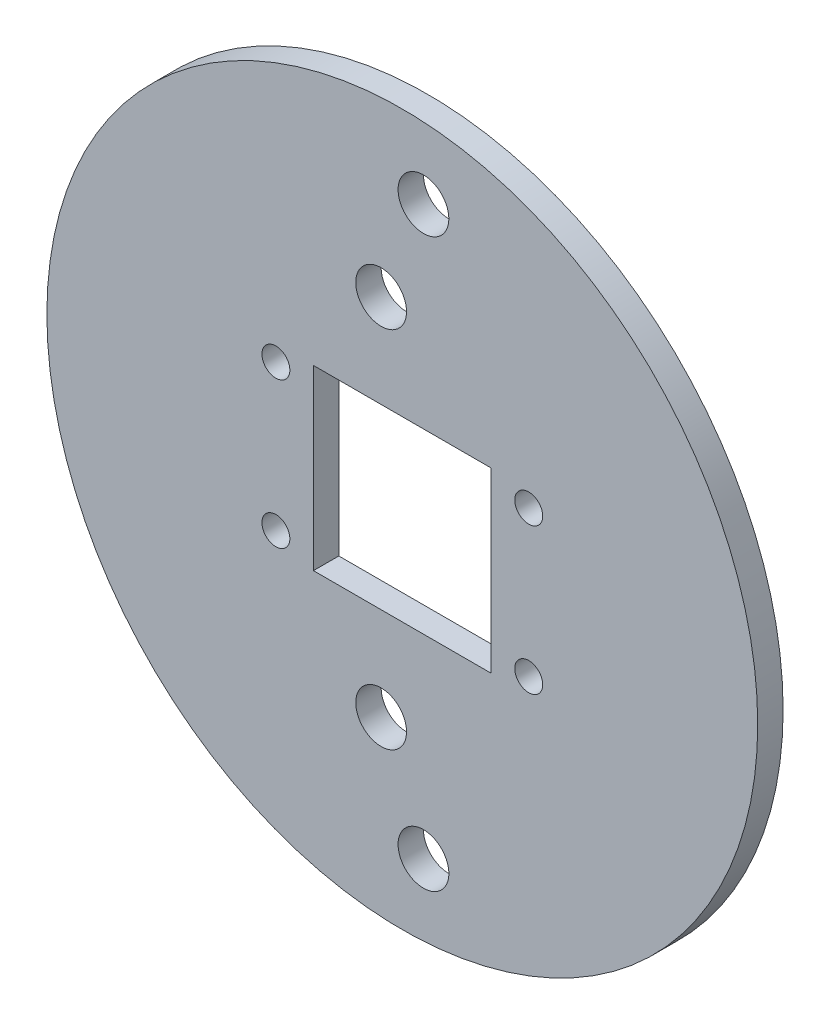
from build123d import *

# Parameters (mm, degrees)
SKETCH_1_R      = 42
SKETCH_1_R_2    = 1.65
SKETCH_1_R_3    = 3
SKETCH_1_W      = 21
SKETCH_1_H      = 21
EXTRUDE_1_DEPTH = 3


with BuildPart() as part:
    # 草图1 → 凸台-拉伸1 (new body)
    with BuildSketch(Plane.XY):
        Circle(SKETCH_1_R)
        with Locations((14.938938215, 8.625)):
            Circle(SKETCH_1_R_2, mode=Mode.SUBTRACT)
        with Locations((14.938938215, -8.625)):
            Circle(SKETCH_1_R_2, mode=Mode.SUBTRACT)
        with Locations((-14.938938215, -8.625)):
            Circle(SKETCH_1_R_2, mode=Mode.SUBTRACT)
        with Locations((-14.938938215, 8.625)):
            Circle(SKETCH_1_R_2, mode=Mode.SUBTRACT)
        with Locations((2.5, 33.5)):
            Circle(SKETCH_1_R_3, mode=Mode.SUBTRACT)
        with Locations((-2.5, 21.5)):
            Circle(SKETCH_1_R_3, mode=Mode.SUBTRACT)
        with Locations(Location((-2.5, -21.5, 0), (0, 0, 180))):
            Circle(SKETCH_1_R_3, mode=Mode.SUBTRACT)
        with Locations(Location((2.5, -33.5, 0), (0, 0, 180))):
            Circle(SKETCH_1_R_3, mode=Mode.SUBTRACT)
        Rectangle(SKETCH_1_W, SKETCH_1_H, mode=Mode.SUBTRACT)
    extrude(amount=EXTRUDE_1_DEPTH)


solid = part.part
